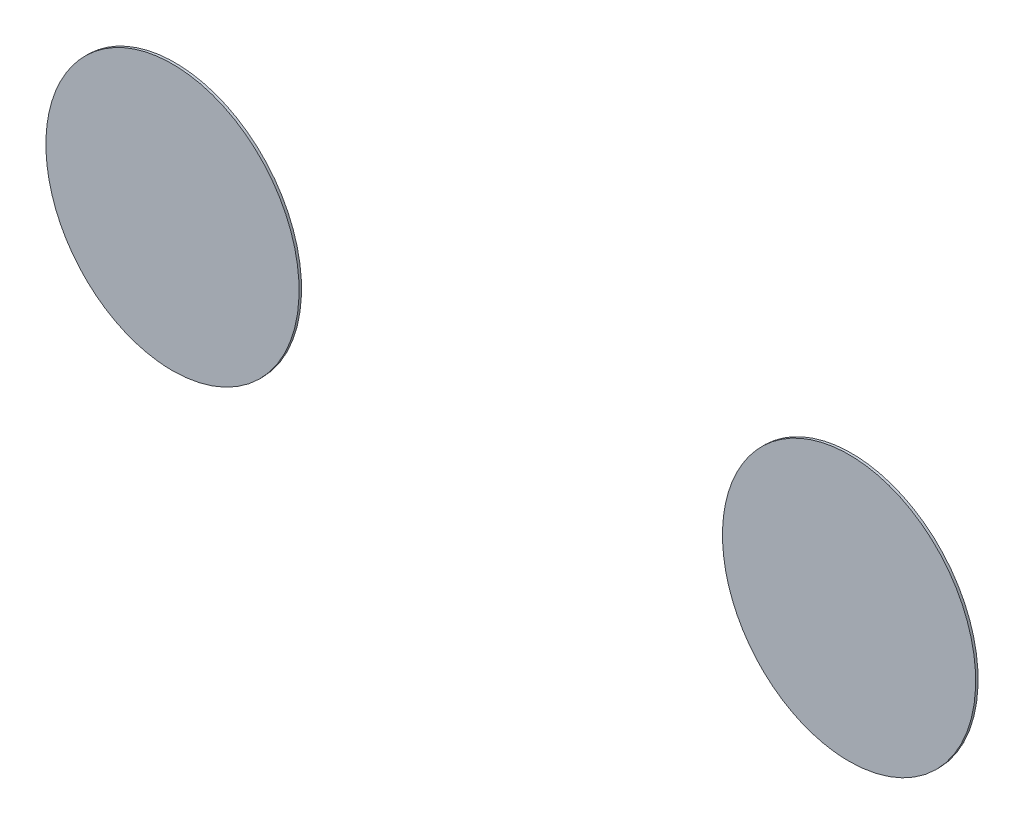
from build123d import *

# Parameters (mm, degrees)
SKETCH1_RX            = 10.906482742
SKETCH1_RY            = 10.395241363
BOSS_EXTRUDE1_DEPTH   = 0.2
BOSS_EXTRUDE1_2_DEPTH = 0.2


with BuildPart() as part:
    # Sketch1 → Boss-Extrude1 (new body)
    with BuildSketch(Plane.XY):
        with Locations(Location((-27.777448233, 131.984792082), (0, 0, -90))):
            Ellipse(SKETCH1_RX, SKETCH1_RY)
    extrude(amount=BOSS_EXTRUDE1_DEPTH)


with BuildPart() as body_2:
    # Sketch1 → Boss-Extrude1 2 (new body)
    with BuildSketch(Plane.XY):
        with Locations(Location((27.777448233, 131.984792082), (0, 0, -90))):
            Ellipse(SKETCH1_RX, SKETCH1_RY)
    extrude(amount=BOSS_EXTRUDE1_2_DEPTH)


solid = Compound([part.part, body_2.part])
